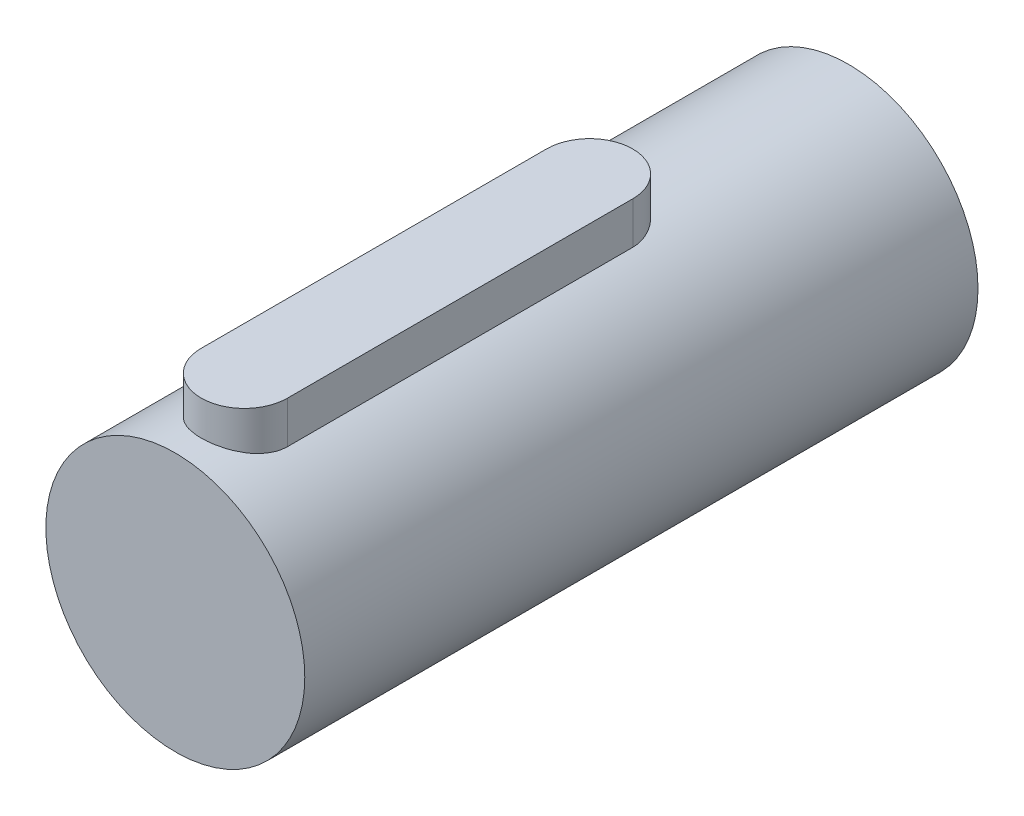
from build123d import *

# Parameters (mm, degrees)
SKETCH1_R           = 7.5
BOSS_EXTRUDE1_DEPTH = 39
BOSS_EXTRUDE2_DEPTH = 5


with BuildPart() as part:
    # Sketch1 → Boss-Extrude1 (new body)
    with BuildSketch(Plane.XY):
        Circle(SKETCH1_R)
    extrude(amount=-BOSS_EXTRUDE1_DEPTH)


with BuildPart() as body_2:
    # Sketch2 → Boss-Extrude2 (new body)
    with BuildSketch(Plane(origin=(0, 9.5, 0), x_dir=(1, 0, 0), z_dir=(0, 1, 0))):
        with BuildLine():
            Line((2.5, 24), (2.5, 4))
            ThreePointArc((2.5, 4), (0, 1.5), (-2.5, 4))
            Line((-2.5, 4), (-2.5, 24))
            ThreePointArc((-2.5, 24), (0, 26.5), (2.5, 24))
        make_face()
    extrude(amount=-BOSS_EXTRUDE2_DEPTH)


solid = Compound([part.part, body_2.part])
